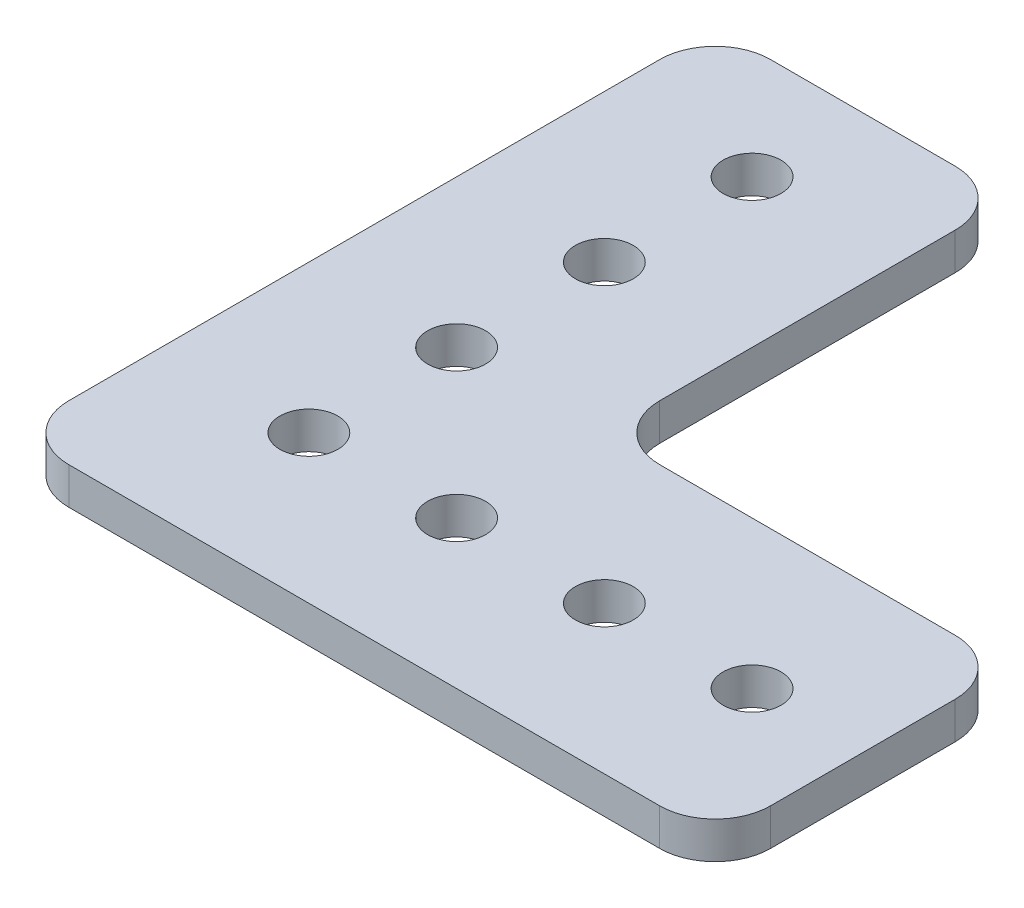
from build123d import *

# Parameters (mm, degrees)
SKETCH1_R           = 2.4892
BOSS_EXTRUDE1_DEPTH = 3.175
FILLET1_R           = 4.7625


with BuildPart() as part:
    # Sketch1 → Boss-Extrude1 (new body)
    with BuildSketch(Plane(origin=(0, 0, 0), x_dir=(1, 0, 0), z_dir=(0, 1, 0))):
        Polygon((0, 0), (0, 60.325), (25.4, 60.325), (25.4, 25.4), (60.325, 25.4), (60.325, 0), align=None)
        with Locations(Location((12.7, 12.7, 0), (0, 0, 270))):
            Circle(SKETCH1_R, mode=Mode.SUBTRACT)
        with Locations(Location((12.7, 25.4, 0), (0, 0, 270))):
            Circle(SKETCH1_R, mode=Mode.SUBTRACT)
        with Locations(Location((12.7, 38.1, 0), (0, 0, 270))):
            Circle(SKETCH1_R, mode=Mode.SUBTRACT)
        with Locations(Location((25.4, 12.7, 0), (0, 0, 270))):
            Circle(SKETCH1_R, mode=Mode.SUBTRACT)
        with Locations(Location((38.1, 12.7, 0), (0, 0, 270))):
            Circle(SKETCH1_R, mode=Mode.SUBTRACT)
        with Locations(Location((50.8, 12.7, 0), (0, 0, 270))):
            Circle(SKETCH1_R, mode=Mode.SUBTRACT)
        with Locations(Location((12.7, 50.8, 0), (0, 0, 270))):
            Circle(SKETCH1_R, mode=Mode.SUBTRACT)
    extrude(amount=BOSS_EXTRUDE1_DEPTH)

    # Fillet1
    fillet1_edges = [part.edges().sort_by_distance(p)[0] for p in [
        (0, 1.5875, 0),
        (0, 1.5875, -60.325),
        (25.4, 1.5875, -60.325),
        (25.4, 1.5875, -25.4),
        (60.325, 1.5875, -25.4),
        (60.325, 1.5875, 0),
    ]]
    fillet(fillet1_edges, radius=FILLET1_R)


solid = part.part
